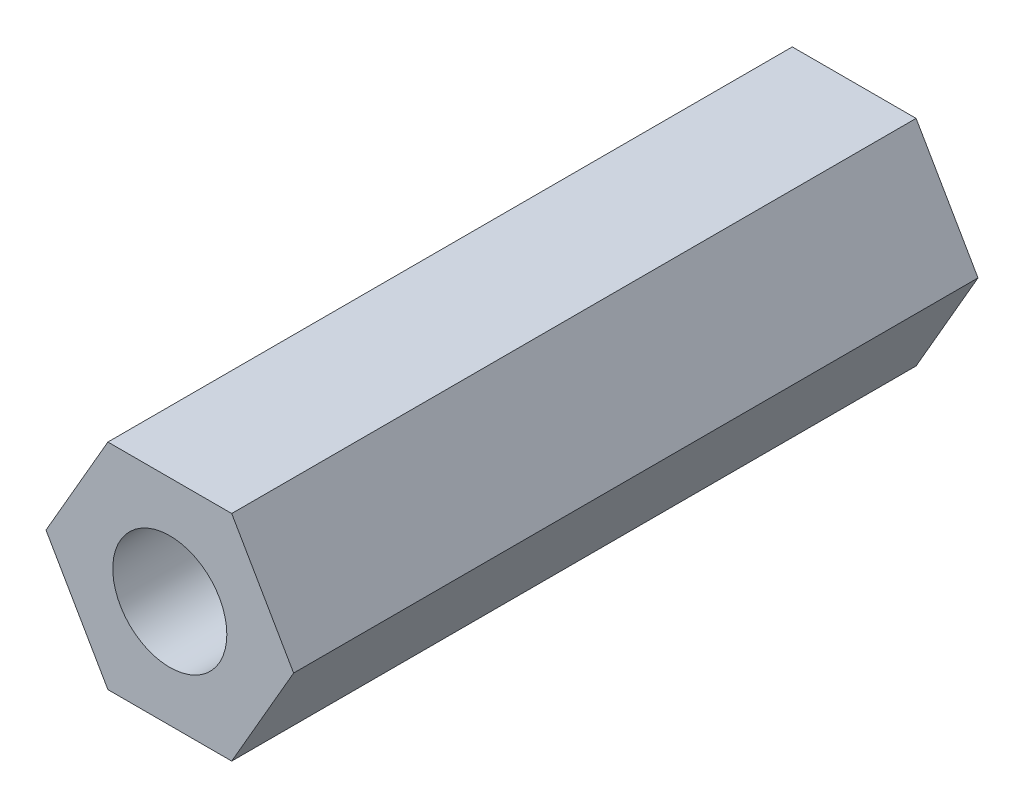
from build123d import *

# Parameters (mm, degrees)
EXTRUDE_1_DEPTH = 7.5


with BuildPart() as part:
    # 草图1 → 凸台-拉伸1 (new, symmetric)
    with BuildSketch(Plane.XY):
        Polygon((1.356773133, 2.35), (-1.356773133, 2.35), (-2.713546265, 0), (-1.356773133, -2.35), (1.356773133, -2.35), (2.713546265, 0), align=None)
    extrude(amount=EXTRUDE_1_DEPTH, both=True)

    # 草图3 → Hole Wizard 387 (revolve, cut)
    with BuildSketch(Plane(origin=(0, 0, 7.5), x_dir=(0, -1, 0), z_dir=(1, 0, 0))):
        Polygon((0, 0), (0, 8.751075774), (1.25, 8), (1.25, 0), align=None)
    hole_wizard_387 = revolve(axis=Axis((0, 0, 13.85), (0, 0, -1)), mode=Mode.SUBTRACT)

    # 镜向1: Hole Wizard 387 across plane
    add(hole_wizard_387.mirror(Plane.XY), mode=Mode.SUBTRACT)


solid = part.part
